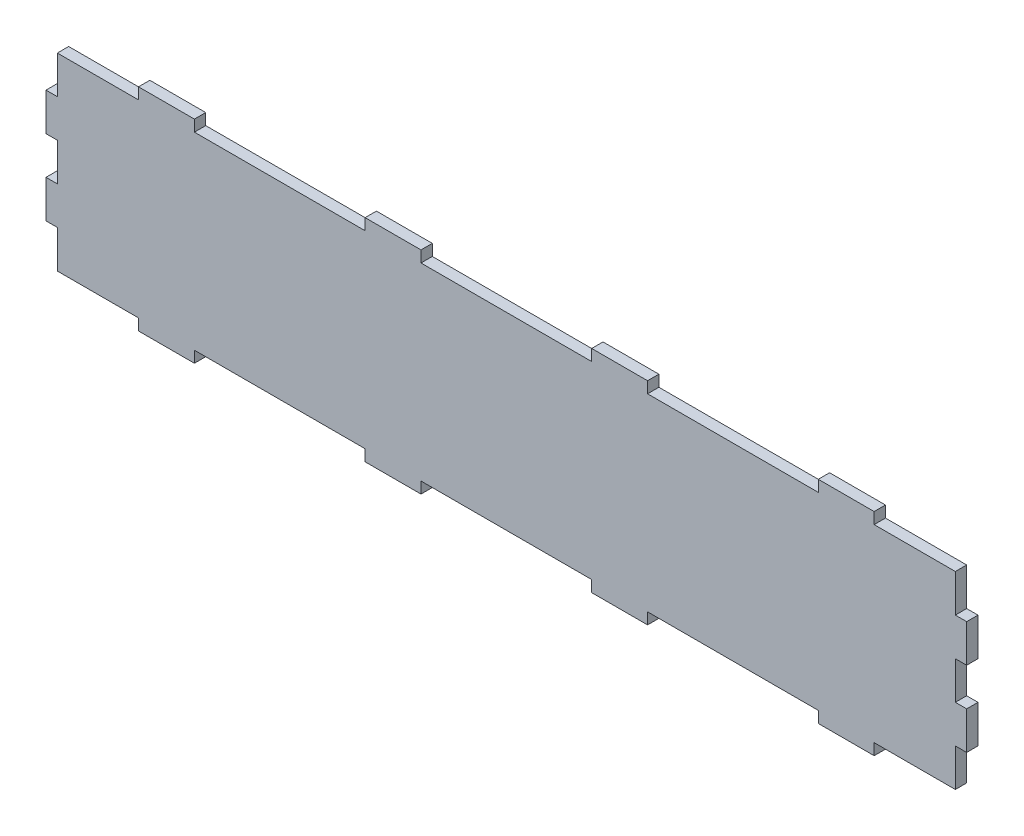
from build123d import *

# Parameters (mm, degrees)
BOSS_EXTRUDE1_DEPTH = 3


with BuildPart() as part:
    # Sketch1 → Boss-Extrude1 (new body)
    with BuildSketch(Plane.XY):
        Polygon((-22.6, 0), (22.6, 0), (22.6, 3), (37.4, 3), (37.4, 0), (82.6, 0), (82.6, 3), (97.4, 3), (97.4, 0), (118.9, 0), (118.9, -10), (121.9, -10), (121.9, -20), (118.9, -20), (118.9, -30), (121.9, -30), (121.9, -40), (118.9, -40), (118.9, -50), (97.4, -50), (97.4, -53), (82.6, -53), (82.6, -50), (37.4, -50), (37.4, -53), (22.6, -53), (22.6, -50), (-22.6, -50), (-22.6, -53), (-37.4, -53), (-37.4, -50), (-82.6, -50), (-82.6, -53), (-97.4, -53), (-97.4, -50), (-118.9, -50), (-118.9, -40), (-121.9, -40), (-121.9, -30), (-118.9, -30), (-118.9, -20), (-121.9, -20), (-121.9, -10), (-118.9, -10), (-118.9, 0), (-97.4, 0), (-97.4, 3), (-82.6, 3), (-82.6, 0), (-37.4, 0), (-37.4, 3), (-22.6, 3), align=None)
    extrude(amount=BOSS_EXTRUDE1_DEPTH)


solid = part.part
